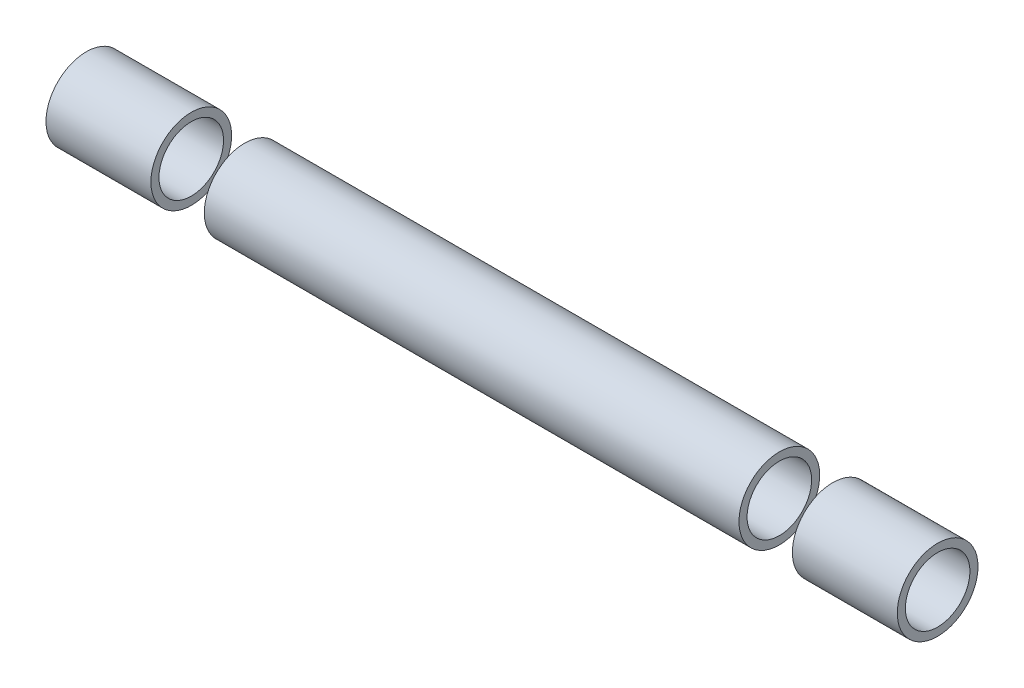
from build123d import *

# Parameters (mm, degrees)
SKETCH1_R               = 15.875
SKETCH1_R_2             = 12.7
EXTRUDE_THIN1_DEPTH     = 167.4495
CUT_EXTRUDE1_DEPTH      = 169.947821236
CUT_EXTRUDE1_DEPTH_BACK = 169.947821236
SKETCH2_W               = 20.99999991
SKETCH2_H               = 31.75


with BuildPart() as part:
    # Sketch1 → Extrude-Thin1 (new, symmetric)
    with BuildSketch(Plane(origin=(0, 0, 0), x_dir=(0, 0, -1), z_dir=(1, 0, 0))):
        Circle(SKETCH1_R)
        Circle(SKETCH1_R_2, mode=Mode.SUBTRACT)
    extrude(amount=EXTRUDE_THIN1_DEPTH, both=True)

    # Sketch2 → Cut-Extrude1 (cut, two sides: drawn at the far end of the back side and taken through both)
    with BuildSketch(Plane.XY.offset(-CUT_EXTRUDE1_DEPTH_BACK)):
        with Locations((115.674500045, 0)):
            Rectangle(SKETCH2_W, SKETCH2_H)
        with Locations((-115.674500045, 0)):
            Rectangle(SKETCH2_W, SKETCH2_H)
    extrude(amount=CUT_EXTRUDE1_DEPTH + CUT_EXTRUDE1_DEPTH_BACK, mode=Mode.SUBTRACT)


with BuildPart() as cut_extrude1_piece_1:
    # of the separate pieces the step leaves, piece 1, a body of its own (cut_extrude1_pieces)
    add(part.part.solids().sort_by_distance((-105.17450009, 0, -15.875))[0])


with BuildPart() as cut_extrude1_piece_2:
    # of the separate pieces the step leaves, piece 2, a body of its own (cut_extrude1_pieces)
    add(part.part.solids().sort_by_distance((-167.4495, 0, -15.875))[0])


with BuildPart() as cut_extrude1_piece_3:
    # of the separate pieces the step leaves, piece 3, a body of its own (cut_extrude1_pieces)
    add(part.part.solids().sort_by_distance((126.1745, 0, -15.875))[0])


solid = Compound([cut_extrude1_piece_1.part, cut_extrude1_piece_2.part, cut_extrude1_piece_3.part])
